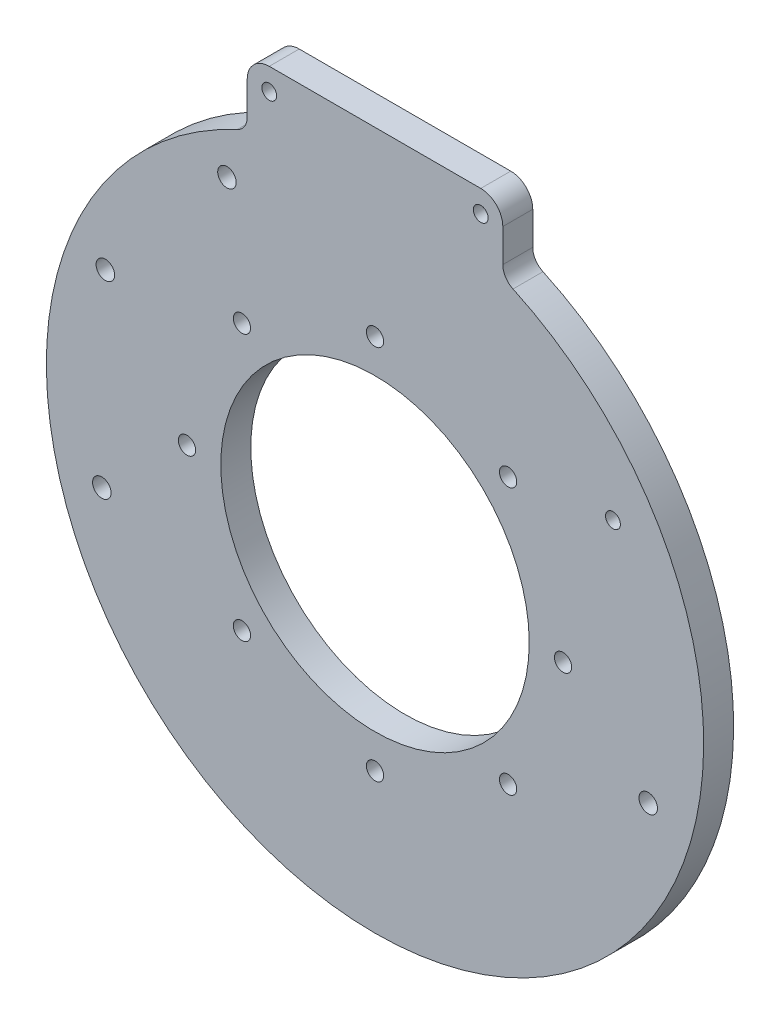
from build123d import *

# Parameters (mm, degrees)
SKETCH1_R                   = 4.5
SKETCH1_R_2                 = 4
SKETCH1_R_3                 = 3.5
SKETCH1_R_4                 = 87.5
BOSS_EXTRUDE1_DEPTH         = 17
F_3_8_CLEARANCE_HOLE1_D     = 9.8044
F_3_8_CLEARANCE_HOLE1_DEPTH = 51.26
F_3_8_CLEARANCE_HOLE1_TIP   = 2.945538927
M10_CLEARANCE_HOLE1_D       = 10.5
M10_CLEARANCE_HOLE1_DEPTH   = 51.26
M10_CLEARANCE_HOLE1_TIP     = 3.15451825
M8_CLEARANCE_HOLE1_D        = 8.4
M8_CLEARANCE_HOLE1_DEPTH    = 51.26
M8_CLEARANCE_HOLE1_TIP      = 2.5236146


with BuildPart() as part:
    # Sketch1 → Boss-Extrude1 (new body)
    with BuildSketch(Plane.XY):
        with BuildLine():
            Line((-60, 209.5), (60, 209.5))
            ThreePointArc((60, 209.5), (68.838834765, 205.838834765), (72.5, 197))
            Line((72.5, 197), (72.5, 178.304283367))
            ThreePointArc((72.5, 178.304283367), (74.07408405, 172.918752715), (78.30078808, 169.228677643))
            ThreePointArc((78.30078808, 169.228677643), (0, -186.465435807), (-78.30078808, 169.228677643))
            ThreePointArc((-78.30078808, 169.228677643), (-74.07408405, 172.918752715), (-72.5, 178.304283367))
            Line((-72.5, 178.304283367), (-72.5, 197))
            ThreePointArc((-72.5, 197), (-68.838834765, 205.838834765), (-60, 209.5))
        make_face()
        with Locations((-84, 143)):
            Circle(SKETCH1_R, mode=Mode.SUBTRACT)
        with Locations((-60, 197)):
            Circle(SKETCH1_R_2, mode=Mode.SUBTRACT)
        with Locations((60, 197)):
            Circle(SKETCH1_R_3, mode=Mode.SUBTRACT)
        with Locations((135, 84)):
            Circle(SKETCH1_R_3, mode=Mode.SUBTRACT)
        with Locations((155, -45)):
            Circle(SKETCH1_R, mode=Mode.SUBTRACT)
        with Locations((-155, -45)):
            Circle(SKETCH1_R, mode=Mode.SUBTRACT)
        Circle(SKETCH1_R_4, mode=Mode.SUBTRACT)
        with Locations((-153, 63)):
            Circle(SKETCH1_R, mode=Mode.SUBTRACT)
    extrude(amount=BOSS_EXTRUDE1_DEPTH)

    # 3/8 Clearance Hole1
    with Locations(Plane(origin=(75.50716213, 75.50716213, 17), x_dir=(1, 0, 0), z_dir=(0, 0, 1))):
        with Locations((0, 0), (0, -151.01432426), (-151.01432426, -151.01432426), (-151.01432426, 0), (-75.50716213, 31.17283787), (31.17283787, -75.50716213), (-182.18716213, -75.50716213), (-75.50716213, -182.18716213)):
            Hole(F_3_8_CLEARANCE_HOLE1_D / 2, depth=F_3_8_CLEARANCE_HOLE1_DEPTH)
            with Locations((0, 0, -(F_3_8_CLEARANCE_HOLE1_DEPTH + F_3_8_CLEARANCE_HOLE1_TIP / 2))):  # 118° drill point
                Cone(0, F_3_8_CLEARANCE_HOLE1_D / 2, F_3_8_CLEARANCE_HOLE1_TIP, mode=Mode.SUBTRACT)

    # M10 Clearance Hole1
    with Locations(Plane(origin=(155, -45, 17), x_dir=(1, 0, 0), z_dir=(0, 0, 1))):
        with Locations((0, 0), (-310, 0), (-308, 108), (-239, 188)):
            Hole(M10_CLEARANCE_HOLE1_D / 2, depth=M10_CLEARANCE_HOLE1_DEPTH)
            with Locations((0, 0, -(M10_CLEARANCE_HOLE1_DEPTH + M10_CLEARANCE_HOLE1_TIP / 2))):  # 118° drill point
                Cone(0, M10_CLEARANCE_HOLE1_D / 2, M10_CLEARANCE_HOLE1_TIP, mode=Mode.SUBTRACT)

    # M8 Clearance Hole1
    with Locations(Plane(origin=(-60, 197, 17), x_dir=(1, 0, 0), z_dir=(0, 0, 1))):
        with Locations((0, 0), (120, 0), (195, -113)):
            Hole(M8_CLEARANCE_HOLE1_D / 2, depth=M8_CLEARANCE_HOLE1_DEPTH)
            with Locations((0, 0, -(M8_CLEARANCE_HOLE1_DEPTH + M8_CLEARANCE_HOLE1_TIP / 2))):  # 118° drill point
                Cone(0, M8_CLEARANCE_HOLE1_D / 2, M8_CLEARANCE_HOLE1_TIP, mode=Mode.SUBTRACT)


solid = part.part
